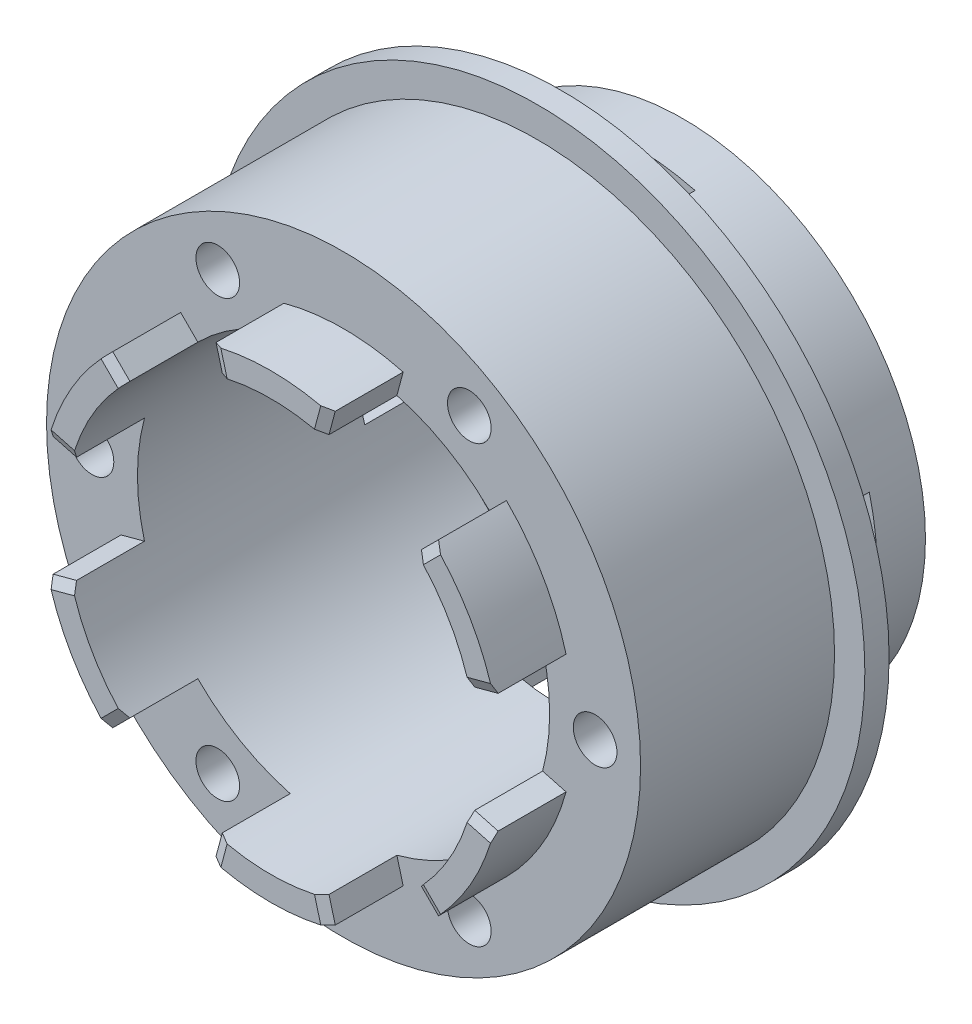
from build123d import *
from OCP.BRepFilletAPI import BRepFilletAPI_MakeChamfer

# Parameters (mm, degrees)
SKETCH_1_R               = 10
EXTRUDE_1_DEPTH          = 2
SKETCH_2_R               = 10
SKETCH_2_R_2             = 8.5
EXTRUDE_2_DEPTH          = 3
SKETCH_4_R               = 13.5
SKETCH_4_R_2             = 8.5
EXTRUDE_3_DEPTH          = 1
SKETCH_5_R               = 12.25
SKETCH_5_R_2             = 8.5
EXTRUDE_4_DEPTH          = 8
SKETCH_6_R               = 0.9
CUT_EXTRUDE_1_DEPTH      = 8
SKETCH_7_R               = 3
SKETCH_7_R_2             = 1.15
CUT_EXTRUDE_2_DEPTH      = 24.674881204
CUT_EXTRUDE_3_DEPTH      = 24.674881204
CUT_EXTRUDE_3_DEPTH_BACK = 24.674881204
SKETCH_8_W               = 5
SKETCH_8_H               = 3
CUT_EXTRUDE_4_DEPTH      = 24.674881204
CUT_EXTRUDE_4_DEPTH_BACK = 24.674881204
SKETCH_9_W               = 3
SKETCH_9_H               = 5
EXTRUDE_5_DEPTH          = 3
CHAMFER_1_SIZE           = 0.2
CHAMFER_1_SIZE2          = 0.410060768


with BuildPart() as part:
    # 스케치1 → 보스-돌출1 (new body)
    with BuildSketch(Plane.XY):
        Circle(SKETCH_1_R)
    extrude(amount=EXTRUDE_1_DEPTH)

    # 스케치2 → 보스-돌출2 (add)
    with BuildSketch(Plane.XY.offset(2)):
        Circle(SKETCH_2_R)
        Circle(SKETCH_2_R_2, mode=Mode.SUBTRACT)
    extrude(amount=EXTRUDE_2_DEPTH)

    # 스케치4 → 보스-돌출3 (add)
    with BuildSketch(Plane.XY.offset(5)):
        Circle(SKETCH_4_R)
        Circle(SKETCH_4_R_2, mode=Mode.SUBTRACT)
    extrude(amount=EXTRUDE_3_DEPTH)

    # 스케치5 → 보스-돌출4 (add)
    with BuildSketch(Plane.XY.offset(6)):
        Circle(SKETCH_5_R)
        Circle(SKETCH_5_R_2, mode=Mode.SUBTRACT)
    extrude(amount=EXTRUDE_4_DEPTH)

    # 스케치6 → 컷-돌출1 (cut)
    with BuildSketch(Plane.XY.offset(14)):
        with Locations((10.375, 0)):
            Circle(SKETCH_6_R)
        with Locations((5.1875, -8.985013564)):
            Circle(SKETCH_6_R)
        with Locations((-5.1875, -8.985013564)):
            Circle(SKETCH_6_R)
        with Locations((-10.375, 0)):
            Circle(SKETCH_6_R)
        with Locations((-5.1875, 8.985013564)):
            Circle(SKETCH_6_R)
        with Locations((5.1875, 8.985013564)):
            Circle(SKETCH_6_R)
    extrude(amount=-CUT_EXTRUDE_1_DEPTH, mode=Mode.SUBTRACT)

    # 스케치7 → 컷-돌출2 (cut, through all)
    with BuildSketch(Plane(origin=(0, 0, 0), x_dir=(-1, 0, 0), z_dir=(0, 0, -1))):
        Circle(SKETCH_7_R)
        with Locations((-7, 0)):
            Circle(SKETCH_7_R_2)
        with Locations((7, 0)):
            Circle(SKETCH_7_R_2)
        with Locations((0, 7)):
            Circle(SKETCH_7_R_2)
        with Locations((0, -7)):
            Circle(SKETCH_7_R_2)
    extrude(amount=-CUT_EXTRUDE_2_DEPTH, mode=Mode.SUBTRACT)

    # 스케치8 → 컷-돌출3 (cut, two sides: drawn at the far end of the back side and taken through both)
    with BuildSketch(Plane(origin=(0, 0, 0), x_dir=(1, 0, 0), z_dir=(0, 1, 0)).offset(-CUT_EXTRUDE_3_DEPTH_BACK)):
        with Locations((0, -3.5)):
            Rectangle(SKETCH_8_W, SKETCH_8_H)
    extrude(amount=CUT_EXTRUDE_3_DEPTH + CUT_EXTRUDE_3_DEPTH_BACK, mode=Mode.SUBTRACT)

    # 스케치9 → 컷-돌출4 (cut, two sides: drawn at the far end of the back side and taken through both)
    with BuildSketch(Plane(origin=(0, 0, 0), x_dir=(0, 0, -1), z_dir=(1, 0, 0)).offset(-CUT_EXTRUDE_4_DEPTH_BACK)):
        with Locations((-3.5, 0)):
            Rectangle(SKETCH_9_W, SKETCH_9_H)
    extrude(amount=CUT_EXTRUDE_4_DEPTH + CUT_EXTRUDE_4_DEPTH_BACK, mode=Mode.SUBTRACT)

    # 스케치10 → 보스-돌출5 (add)
    with BuildSketch(Plane.XY.offset(14)):
        with BuildLine():
            Line((2.199961883, 8.210369523), (2.458780928, 9.17629535))
            ThreePointArc((2.458780928, 9.17629535), (0, 9.5), (-2.458780928, 9.17629535))
            Line((-2.458780928, 9.17629535), (-2.199961883, 8.210369523))
            ThreePointArc((-2.199961883, 8.210369523), (0, 8.5), (2.199961883, 8.210369523))
        make_face()
        with BuildLine():
            Line((6.01040764, 6.01040764), (6.717514421, 6.717514421))
            ThreePointArc((6.717514421, 6.717514421), (8.227241336, 4.75), (9.17629535, 2.458780928))
            Line((9.17629535, 2.458780928), (8.210369523, 2.199961883))
            ThreePointArc((8.210369523, 2.199961883), (7.361215932, 4.25), (6.01040764, 6.01040764))
        make_face()
        with BuildLine():
            Line((8.210369523, -2.199961883), (9.17629535, -2.458780928))
            ThreePointArc((9.17629535, -2.458780928), (8.227241336, -4.75), (6.717514421, -6.717514421))
            Line((6.717514421, -6.717514421), (6.01040764, -6.01040764))
            ThreePointArc((6.01040764, -6.01040764), (7.361215932, -4.25), (8.210369523, -2.199961883))
        make_face()
        with BuildLine():
            Line((2.199961883, -8.210369523), (2.458780928, -9.17629535))
            ThreePointArc((2.458780928, -9.17629535), (0, -9.5), (-2.458780928, -9.17629535))
            Line((-2.458780928, -9.17629535), (-2.199961883, -8.210369523))
            ThreePointArc((-2.199961883, -8.210369523), (0, -8.5), (2.199961883, -8.210369523))
        make_face()
        with BuildLine():
            Line((-6.01040764, -6.01040764), (-6.717514421, -6.717514421))
            ThreePointArc((-6.717514421, -6.717514421), (-8.227241336, -4.75), (-9.17629535, -2.458780928))
            Line((-9.17629535, -2.458780928), (-8.210369523, -2.199961883))
            ThreePointArc((-8.210369523, -2.199961883), (-7.361215932, -4.25), (-6.01040764, -6.01040764))
        make_face()
        with BuildLine():
            Line((-8.210369523, 2.199961883), (-9.17629535, 2.458780928))
            ThreePointArc((-9.17629535, 2.458780928), (-8.227241336, 4.75), (-6.717514421, 6.717514421))
            Line((-6.717514421, 6.717514421), (-6.01040764, 6.01040764))
            ThreePointArc((-6.01040764, 6.01040764), (-7.361215932, 4.25), (-8.210369523, 2.199961883))
        make_face()
    extrude(amount=EXTRUDE_5_DEPTH)

    # 모따기1: one chamfer whose edges measure the first distance from different faces: ONE call of the kernel's chamfer builder (chamfer() names one face for all edges)
    chamfer_1_edges_1 = [part.edges().sort_by_distance(p)[0] for p in [
        (-6.363961031, 6.363961031, 17),
    ]]
    chamfer_1_side_1 = [part.faces().sort_by_distance(p)[0] for p in [
        (-6.363961031, 6.363961031, 15.5),
    ]]
    chamfer_1_edges_2 = [part.edges().sort_by_distance(p)[0] for p in [
        (-8.693332437, 2.329371406, 17),
    ]]
    chamfer_1_side_2 = [part.faces().sort_by_distance(p)[0] for p in [
        (-8.693332437, 2.329371406, 15.5),
    ]]
    chamfer_1_edges_3 = [part.edges().sort_by_distance(p)[0] for p in [
        (-8.693332437, -2.329371406, 17),
    ]]
    chamfer_1_side_3 = [part.faces().sort_by_distance(p)[0] for p in [
        (-8.693332437, -2.329371406, 15.5),
    ]]
    chamfer_1_edges_4 = [part.edges().sort_by_distance(p)[0] for p in [
        (-6.363961031, -6.363961031, 17),
    ]]
    chamfer_1_side_4 = [part.faces().sort_by_distance(p)[0] for p in [
        (-6.363961031, -6.363961031, 15.5),
    ]]
    chamfer_1_edges_5 = [part.edges().sort_by_distance(p)[0] for p in [
        (-2.329371406, 8.693332437, 17),
    ]]
    chamfer_1_side_5 = [part.faces().sort_by_distance(p)[0] for p in [
        (-2.329371406, 8.693332437, 15.5),
    ]]
    chamfer_1_edges_6 = [part.edges().sort_by_distance(p)[0] for p in [
        (2.329371406, 8.693332437, 17),
    ]]
    chamfer_1_side_6 = [part.faces().sort_by_distance(p)[0] for p in [
        (2.329371406, 8.693332437, 15.5),
    ]]
    chamfer_1_edges_7 = [part.edges().sort_by_distance(p)[0] for p in [
        (-2.329371406, -8.693332437, 17),
    ]]
    chamfer_1_side_7 = [part.faces().sort_by_distance(p)[0] for p in [
        (-2.329371406, -8.693332437, 15.5),
    ]]
    chamfer_1_edges_8 = [part.edges().sort_by_distance(p)[0] for p in [
        (2.329371406, -8.693332437, 17),
    ]]
    chamfer_1_side_8 = [part.faces().sort_by_distance(p)[0] for p in [
        (2.329371406, -8.693332437, 15.5),
    ]]
    chamfer_1_edges_9 = [part.edges().sort_by_distance(p)[0] for p in [
        (6.363961031, 6.363961031, 17),
    ]]
    chamfer_1_side_9 = [part.faces().sort_by_distance(p)[0] for p in [
        (6.363961031, 6.363961031, 15.5),
    ]]
    chamfer_1_edges_10 = [part.edges().sort_by_distance(p)[0] for p in [
        (8.693332437, 2.329371406, 17),
    ]]
    chamfer_1_side_10 = [part.faces().sort_by_distance(p)[0] for p in [
        (8.693332437, 2.329371406, 15.5),
    ]]
    chamfer_1_edges_11 = [part.edges().sort_by_distance(p)[0] for p in [
        (6.363961031, -6.363961031, 17),
    ]]
    chamfer_1_side_11 = [part.faces().sort_by_distance(p)[0] for p in [
        (6.363961031, -6.363961031, 15.5),
    ]]
    chamfer_1_edges_12 = [part.edges().sort_by_distance(p)[0] for p in [
        (8.693332437, -2.329371406, 17),
    ]]
    chamfer_1_side_12 = [part.faces().sort_by_distance(p)[0] for p in [
        (8.693332437, -2.329371406, 15.5),
    ]]
    chamfer_1 = BRepFilletAPI_MakeChamfer(part.part.solid().wrapped)
    for e in chamfer_1_edges_1:
        chamfer_1.Add(CHAMFER_1_SIZE, CHAMFER_1_SIZE2, e.wrapped, chamfer_1_side_1[0].wrapped)  # the first distance lies on this face
    for e in chamfer_1_edges_2:
        chamfer_1.Add(CHAMFER_1_SIZE, CHAMFER_1_SIZE2, e.wrapped, chamfer_1_side_2[0].wrapped)  # the first distance lies on this face
    for e in chamfer_1_edges_3:
        chamfer_1.Add(CHAMFER_1_SIZE, CHAMFER_1_SIZE2, e.wrapped, chamfer_1_side_3[0].wrapped)  # the first distance lies on this face
    for e in chamfer_1_edges_4:
        chamfer_1.Add(CHAMFER_1_SIZE, CHAMFER_1_SIZE2, e.wrapped, chamfer_1_side_4[0].wrapped)  # the first distance lies on this face
    for e in chamfer_1_edges_5:
        chamfer_1.Add(CHAMFER_1_SIZE, CHAMFER_1_SIZE2, e.wrapped, chamfer_1_side_5[0].wrapped)  # the first distance lies on this face
    for e in chamfer_1_edges_6:
        chamfer_1.Add(CHAMFER_1_SIZE, CHAMFER_1_SIZE2, e.wrapped, chamfer_1_side_6[0].wrapped)  # the first distance lies on this face
    for e in chamfer_1_edges_7:
        chamfer_1.Add(CHAMFER_1_SIZE, CHAMFER_1_SIZE2, e.wrapped, chamfer_1_side_7[0].wrapped)  # the first distance lies on this face
    for e in chamfer_1_edges_8:
        chamfer_1.Add(CHAMFER_1_SIZE, CHAMFER_1_SIZE2, e.wrapped, chamfer_1_side_8[0].wrapped)  # the first distance lies on this face
    for e in chamfer_1_edges_9:
        chamfer_1.Add(CHAMFER_1_SIZE, CHAMFER_1_SIZE2, e.wrapped, chamfer_1_side_9[0].wrapped)  # the first distance lies on this face
    for e in chamfer_1_edges_10:
        chamfer_1.Add(CHAMFER_1_SIZE, CHAMFER_1_SIZE2, e.wrapped, chamfer_1_side_10[0].wrapped)  # the first distance lies on this face
    for e in chamfer_1_edges_11:
        chamfer_1.Add(CHAMFER_1_SIZE, CHAMFER_1_SIZE2, e.wrapped, chamfer_1_side_11[0].wrapped)  # the first distance lies on this face
    for e in chamfer_1_edges_12:
        chamfer_1.Add(CHAMFER_1_SIZE, CHAMFER_1_SIZE2, e.wrapped, chamfer_1_side_12[0].wrapped)  # the first distance lies on this face
    add(Compound.cast(chamfer_1.Shape()), mode=Mode.REPLACE)


solid = part.part
